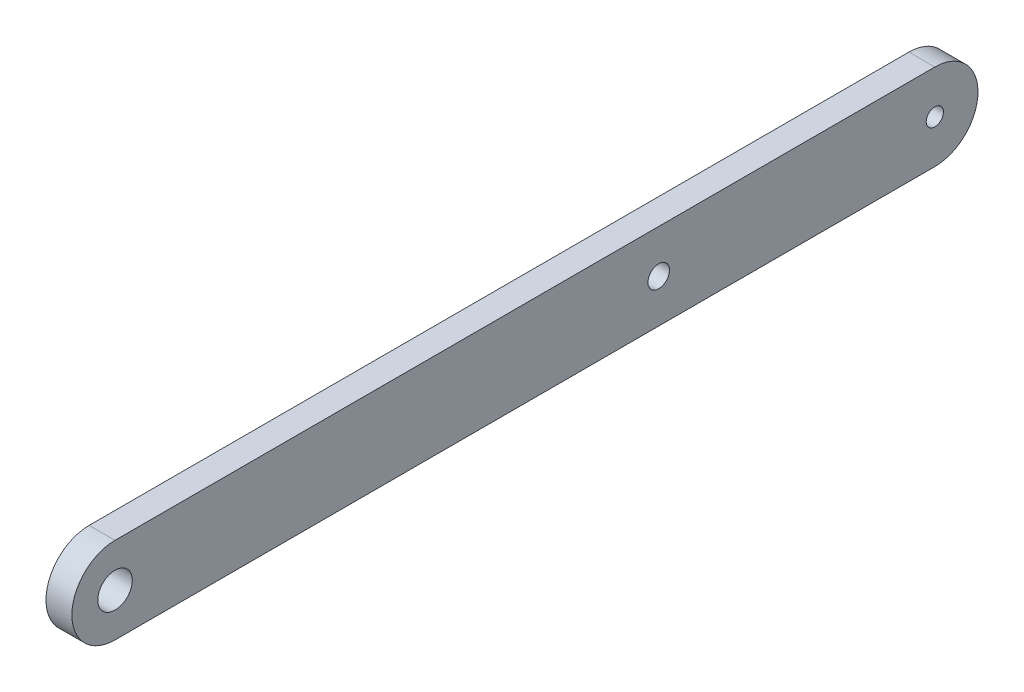
from build123d import *

# Parameters (mm, degrees)
SKETCH1_R           = 2
SKETCH1_R_2         = 1
SKETCH1_R_3         = 1.25
BOSS_EXTRUDE1_DEPTH = 3


with BuildPart() as part:
    # Sketch1 → Boss-Extrude1 (new body)
    with BuildSketch(Plane(origin=(0, 0, 0), x_dir=(0, 0, -1), z_dir=(1, 0, 0))):
        with BuildLine():
            Line((0, 0), (95, 0))
            ThreePointArc((95, 0), (100, 5), (95, 10))
            Line((95, 10), (0, 10))
            ThreePointArc((0, 10), (-5, 5), (0, 0))
        make_face()
        with Locations((0, 5)):
            Circle(SKETCH1_R, mode=Mode.SUBTRACT)
        with Locations((95, 5)):
            Circle(SKETCH1_R_2, mode=Mode.SUBTRACT)
        with Locations((63, 5)):
            Circle(SKETCH1_R_3, mode=Mode.SUBTRACT)
    extrude(amount=BOSS_EXTRUDE1_DEPTH)


solid = part.part
